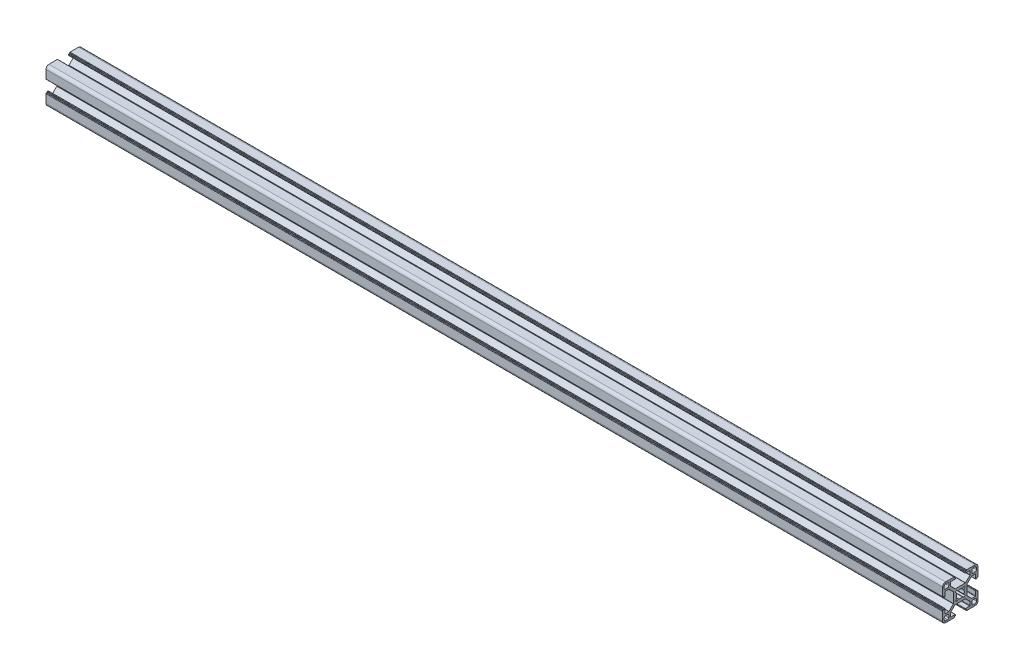
from build123d import *

# Parameters (mm, degrees)
BOSS_EXTRUDE1_DEPTH = 760


with BuildPart() as part:
    # Sketch1 → Boss-Extrude1 (new body)
    with BuildSketch(Plane(origin=(0, 0, 0), x_dir=(0, 0, -1), z_dir=(1, 0, 0))):
        with BuildLine():
            Line((-8.25, 9.788477631), (-8.25, 12.7))
            ThreePointArc((-8.25, 12.7), (-8.162132034, 12.912132034), (-7.95, 13))
            Line((-7.95, 13), (-4.4, 13))
            ThreePointArc((-4.4, 13), (-4.187867966, 13.087867966), (-4.1, 13.3))
            Line((-4.1, 13.3), (-4.1, 13.7))
            ThreePointArc((-4.1, 13.7), (-4.187867966, 13.912132034), (-4.4, 14))
            Line((-4.4, 14), (-4.8, 14))
            ThreePointArc((-4.8, 14), (-5.012132034, 14.087867966), (-5.1, 14.3))
            Line((-5.1, 14.3), (-5.1, 14.7))
            ThreePointArc((-5.1, 14.7), (-5.187867966, 14.912132034), (-5.4, 15))
            Line((-5.4, 15), (-12.5, 15))
            ThreePointArc((-12.5, 15), (-14.267766953, 14.267766953), (-15, 12.5))
            Line((-15, 12.5), (-15, 5.4))
            ThreePointArc((-15, 5.4), (-14.912132034, 5.187867966), (-14.7, 5.1))
            Line((-14.7, 5.1), (-14.3, 5.1))
            ThreePointArc((-14.3, 5.1), (-14.087867966, 5.012132034), (-14, 4.8))
            Line((-14, 4.8), (-14, 4.4))
            ThreePointArc((-14, 4.4), (-13.912132034, 4.187867966), (-13.7, 4.1))
            Line((-13.7, 4.1), (-13.3, 4.1))
            ThreePointArc((-13.3, 4.1), (-13.087867966, 4.187867966), (-13, 4.4))
            Line((-13, 4.4), (-13, 7.95))
            ThreePointArc((-13, 7.95), (-12.912132034, 8.162132034), (-12.7, 8.25))
            Line((-12.7, 8.25), (-9.788477631, 8.25))
            ThreePointArc((-9.788477631, 8.25), (-9.673672601, 8.22716386), (-9.576345597, 8.162132034))
            Line((-9.576345597, 8.162132034), (-5.887867966, 4.473654403))
            ThreePointArc((-5.887867966, 4.473654403), (-5.82283614, 4.376327399), (-5.8, 4.261522369))
            Line((-5.8, 4.261522369), (-5.8, -4.261522369))
            ThreePointArc((-5.8, -4.261522369), (-5.82283614, -4.376327399), (-5.887867966, -4.473654403))
            Line((-5.887867966, -4.473654403), (-9.576345597, -8.162132034))
            ThreePointArc((-9.576345597, -8.162132034), (-9.673672601, -8.22716386), (-9.788477631, -8.25))
            Line((-9.788477631, -8.25), (-12.7, -8.25))
            ThreePointArc((-12.7, -8.25), (-12.912132034, -8.162132034), (-13, -7.95))
            Line((-13, -7.95), (-13, -4.4))
            ThreePointArc((-13, -4.4), (-13.087867966, -4.187867966), (-13.3, -4.1))
            Line((-13.3, -4.1), (-13.7, -4.1))
            ThreePointArc((-13.7, -4.1), (-13.912132034, -4.187867966), (-14, -4.4))
            Line((-14, -4.4), (-14, -4.8))
            ThreePointArc((-14, -4.8), (-14.087867966, -5.012132034), (-14.3, -5.1))
            Line((-14.3, -5.1), (-14.7, -5.1))
            ThreePointArc((-14.7, -5.1), (-14.912132034, -5.187867966), (-15, -5.4))
            Line((-15, -5.4), (-15, -12.5))
            ThreePointArc((-15, -12.5), (-14.267766953, -14.267766953), (-12.5, -15))
            Line((-12.5, -15), (-5.4, -15))
            ThreePointArc((-5.4, -15), (-5.187867966, -14.912132034), (-5.1, -14.7))
            Line((-5.1, -14.7), (-5.1, -14.3))
            ThreePointArc((-5.1, -14.3), (-5.012132034, -14.087867966), (-4.8, -14))
            Line((-4.8, -14), (-4.4, -14))
            ThreePointArc((-4.4, -14), (-4.187867966, -13.912132034), (-4.1, -13.7))
            Line((-4.1, -13.7), (-4.1, -13.3))
            ThreePointArc((-4.1, -13.3), (-4.187867966, -13.087867966), (-4.4, -13))
            Line((-4.4, -13), (-7.95, -13))
            ThreePointArc((-7.95, -13), (-8.162132034, -12.912132034), (-8.25, -12.7))
            Line((-8.25, -12.7), (-8.25, -9.788477631))
            ThreePointArc((-8.25, -9.788477631), (-8.22716386, -9.673672601), (-8.162132034, -9.576345597))
            Line((-8.162132034, -9.576345597), (-4.473654403, -5.887867966))
            ThreePointArc((-4.473654403, -5.887867966), (-4.376327399, -5.82283614), (-4.261522369, -5.8))
            Line((-4.261522369, -5.8), (4.261522369, -5.8))
            ThreePointArc((4.261522369, -5.8), (4.376327399, -5.82283614), (4.473654403, -5.887867966))
            Line((4.473654403, -5.887867966), (8.162132034, -9.576345597))
            ThreePointArc((8.162132034, -9.576345597), (8.22716386, -9.673672601), (8.25, -9.788477631))
            Line((8.25, -9.788477631), (8.25, -12.7))
            ThreePointArc((8.25, -12.7), (8.162132034, -12.912132034), (7.95, -13))
            Line((7.95, -13), (4.4, -13))
            ThreePointArc((4.4, -13), (4.187867966, -13.087867966), (4.1, -13.3))
            Line((4.1, -13.3), (4.1, -13.7))
            ThreePointArc((4.1, -13.7), (4.187867966, -13.912132034), (4.4, -14))
            Line((4.4, -14), (4.8, -14))
            ThreePointArc((4.8, -14), (5.012132034, -14.087867966), (5.1, -14.3))
            Line((5.1, -14.3), (5.1, -14.7))
            ThreePointArc((5.1, -14.7), (5.187867966, -14.912132034), (5.4, -15))
            Line((5.4, -15), (12.5, -15))
            ThreePointArc((12.5, -15), (14.267766953, -14.267766953), (15, -12.5))
            Line((15, -12.5), (15, -5.4))
            ThreePointArc((15, -5.4), (14.912132034, -5.187867966), (14.7, -5.1))
            Line((14.7, -5.1), (14.3, -5.1))
            ThreePointArc((14.3, -5.1), (14.087867966, -5.012132034), (14, -4.8))
            Line((14, -4.8), (14, -4.4))
            ThreePointArc((14, -4.4), (13.912132034, -4.187867966), (13.7, -4.1))
            Line((13.7, -4.1), (13.3, -4.1))
            ThreePointArc((13.3, -4.1), (13.087867966, -4.187867966), (13, -4.4))
            Line((13, -4.4), (13, -7.95))
            ThreePointArc((13, -7.95), (12.912132034, -8.162132034), (12.7, -8.25))
            Line((12.7, -8.25), (9.788477631, -8.25))
            ThreePointArc((9.788477631, -8.25), (9.673672601, -8.22716386), (9.576345597, -8.162132034))
            Line((9.576345597, -8.162132034), (5.887867966, -4.473654403))
            ThreePointArc((5.887867966, -4.473654403), (5.82283614, -4.376327399), (5.8, -4.261522369))
            Line((5.8, -4.261522369), (5.8, 4.261522369))
            ThreePointArc((5.8, 4.261522369), (5.82283614, 4.376327399), (5.887867966, 4.473654403))
            Line((5.887867966, 4.473654403), (9.576345597, 8.162132034))
            ThreePointArc((9.576345597, 8.162132034), (9.673672601, 8.22716386), (9.788477631, 8.25))
            Line((9.788477631, 8.25), (12.7, 8.25))
            ThreePointArc((12.7, 8.25), (12.912132034, 8.162132034), (13, 7.95))
            Line((13, 7.95), (13, 4.4))
            ThreePointArc((13, 4.4), (13.087867966, 4.187867966), (13.3, 4.1))
            Line((13.3, 4.1), (13.7, 4.1))
            ThreePointArc((13.7, 4.1), (13.912132034, 4.187867966), (14, 4.4))
            Line((14, 4.4), (14, 4.8))
            ThreePointArc((14, 4.8), (14.087867966, 5.012132034), (14.3, 5.1))
            Line((14.3, 5.1), (14.7, 5.1))
            ThreePointArc((14.7, 5.1), (14.912132034, 5.187867966), (15, 5.4))
            Line((15, 5.4), (15, 12.5))
            ThreePointArc((15, 12.5), (14.267766953, 14.267766953), (12.5, 15))
            Line((12.5, 15), (5.4, 15))
            ThreePointArc((5.4, 15), (5.187867966, 14.912132034), (5.1, 14.7))
            Line((5.1, 14.7), (5.1, 14.3))
            ThreePointArc((5.1, 14.3), (5.012132034, 14.087867966), (4.8, 14))
            Line((4.8, 14), (4.4, 14))
            ThreePointArc((4.4, 14), (4.187867966, 13.912132034), (4.1, 13.7))
            Line((4.1, 13.7), (4.1, 13.3))
            ThreePointArc((4.1, 13.3), (4.187867966, 13.087867966), (4.4, 13))
            Line((4.4, 13), (7.95, 13))
            ThreePointArc((7.95, 13), (8.162132034, 12.912132034), (8.25, 12.7))
            Line((8.25, 12.7), (8.25, 9.788477631))
            ThreePointArc((8.25, 9.788477631), (8.22716386, 9.673672601), (8.162132034, 9.576345597))
            Line((8.162132034, 9.576345597), (4.473654403, 5.887867966))
            ThreePointArc((4.473654403, 5.887867966), (4.376327399, 5.82283614), (4.261522369, 5.8))
            Line((4.261522369, 5.8), (-4.261522369, 5.8))
            ThreePointArc((-4.261522369, 5.8), (-4.376327399, 5.82283614), (-4.473654403, 5.887867966))
            Line((-4.473654403, 5.887867966), (-8.162132034, 9.576345597))
            ThreePointArc((-8.162132034, 9.576345597), (-8.22716386, 9.673672601), (-8.25, 9.788477631))
        make_face()
        with BuildLine():
            Line((3.05514787, -1.904659815), (3.741964502, -2.698343541))
            ThreePointArc((3.741964502, -2.698343541), (3.70396732, -3.720635173), (2.68151539, -3.75404201))
            Line((2.68151539, -3.75404201), (1.890923385, -3.06366876))
            ThreePointArc((1.890923385, -3.06366876), (1.729867527, -2.991839768), (1.556279141, -3.022911715))
            ThreePointArc((1.556279141, -3.022911715), (0, -3.4), (-1.55627914, -3.022911715))
            ThreePointArc((-1.55627914, -3.022911715), (-1.729867526, -2.991839768), (-1.890923385, -3.06366876))
            Line((-1.890923385, -3.06366876), (-2.68151539, -3.75404201))
            ThreePointArc((-2.68151539, -3.75404201), (-3.70396732, -3.720635173), (-3.741964502, -2.698343541))
            Line((-3.741964502, -2.698343541), (-3.05514787, -1.904659815))
            ThreePointArc((-3.05514787, -1.904659815), (-2.984042722, -1.743283077), (-3.015893746, -1.56983595))
            ThreePointArc((-3.015893746, -1.56983595), (-3.4, 0), (-3.015893746, 1.56983595))
            ThreePointArc((-3.015893746, 1.56983595), (-2.984042722, 1.743283077), (-3.05514787, 1.904659815))
            Line((-3.05514787, 1.904659815), (-3.741964502, 2.698343541))
            ThreePointArc((-3.741964502, 2.698343541), (-3.70396732, 3.720635173), (-2.68151539, 3.75404201))
            Line((-2.68151539, 3.75404201), (-1.890923385, 3.06366876))
            ThreePointArc((-1.890923385, 3.06366876), (-1.729867526, 2.991839768), (-1.55627914, 3.022911715))
            ThreePointArc((-1.55627914, 3.022911715), (0, 3.4), (1.556279141, 3.022911715))
            ThreePointArc((1.556279141, 3.022911715), (1.729867527, 2.991839768), (1.890923385, 3.06366876))
            Line((1.890923385, 3.06366876), (2.68151539, 3.75404201))
            ThreePointArc((2.68151539, 3.75404201), (3.70396732, 3.720635173), (3.741964502, 2.698343541))
            Line((3.741964502, 2.698343541), (3.05514787, 1.904659815))
            ThreePointArc((3.05514787, 1.904659815), (2.984042722, 1.743283077), (3.015893747, 1.56983595))
            ThreePointArc((3.015893747, 1.56983595), (3.4, 0), (3.015893747, -1.56983595))
            ThreePointArc((3.015893747, -1.56983595), (2.984042722, -1.743283077), (3.05514787, -1.904659815))
        make_face(mode=Mode.SUBTRACT)
        with BuildLine():
            Line((10.75, -9.75), (12.65, -9.75))
            ThreePointArc((12.65, -9.75), (13.357106781, -10.042893219), (13.65, -10.75))
            Line((13.65, -10.75), (13.65, -12.15))
            ThreePointArc((13.65, -12.15), (13.210660172, -13.210660172), (12.15, -13.65))
            Line((12.15, -13.65), (10.75, -13.65))
            ThreePointArc((10.75, -13.65), (10.042893219, -13.357106781), (9.75, -12.65))
            Line((9.75, -12.65), (9.75, -10.75))
            ThreePointArc((9.75, -10.75), (10.042893219, -10.042893219), (10.75, -9.75))
        make_face(mode=Mode.SUBTRACT)
        with BuildLine():
            Line((-10.75, 9.75), (-12.65, 9.75))
            ThreePointArc((-12.65, 9.75), (-13.357106781, 10.042893219), (-13.65, 10.75))
            Line((-13.65, 10.75), (-13.65, 12.15))
            ThreePointArc((-13.65, 12.15), (-13.210660172, 13.210660172), (-12.15, 13.65))
            Line((-12.15, 13.65), (-10.75, 13.65))
            ThreePointArc((-10.75, 13.65), (-10.042893219, 13.357106781), (-9.75, 12.65))
            Line((-9.75, 12.65), (-9.75, 10.75))
            ThreePointArc((-9.75, 10.75), (-10.042893219, 10.042893219), (-10.75, 9.75))
        make_face(mode=Mode.SUBTRACT)
        with BuildLine():
            Line((9.75, 10.75), (9.75, 12.65))
            ThreePointArc((9.75, 12.65), (10.042893219, 13.357106781), (10.75, 13.65))
            Line((10.75, 13.65), (12.15, 13.65))
            ThreePointArc((12.15, 13.65), (13.210660172, 13.210660172), (13.65, 12.15))
            Line((13.65, 12.15), (13.65, 10.75))
            ThreePointArc((13.65, 10.75), (13.357106781, 10.042893219), (12.65, 9.75))
            Line((12.65, 9.75), (10.75, 9.75))
            ThreePointArc((10.75, 9.75), (10.042893219, 10.042893219), (9.75, 10.75))
        make_face(mode=Mode.SUBTRACT)
        with BuildLine():
            Line((-9.75, -10.75), (-9.75, -12.65))
            ThreePointArc((-9.75, -12.65), (-10.042893219, -13.357106781), (-10.75, -13.65))
            Line((-10.75, -13.65), (-12.15, -13.65))
            ThreePointArc((-12.15, -13.65), (-13.210660172, -13.210660172), (-13.65, -12.15))
            Line((-13.65, -12.15), (-13.65, -10.75))
            ThreePointArc((-13.65, -10.75), (-13.357106781, -10.042893219), (-12.65, -9.75))
            Line((-12.65, -9.75), (-10.75, -9.75))
            ThreePointArc((-10.75, -9.75), (-10.042893219, -10.042893219), (-9.75, -10.75))
        make_face(mode=Mode.SUBTRACT)
    extrude(amount=BOSS_EXTRUDE1_DEPTH)


solid = part.part
